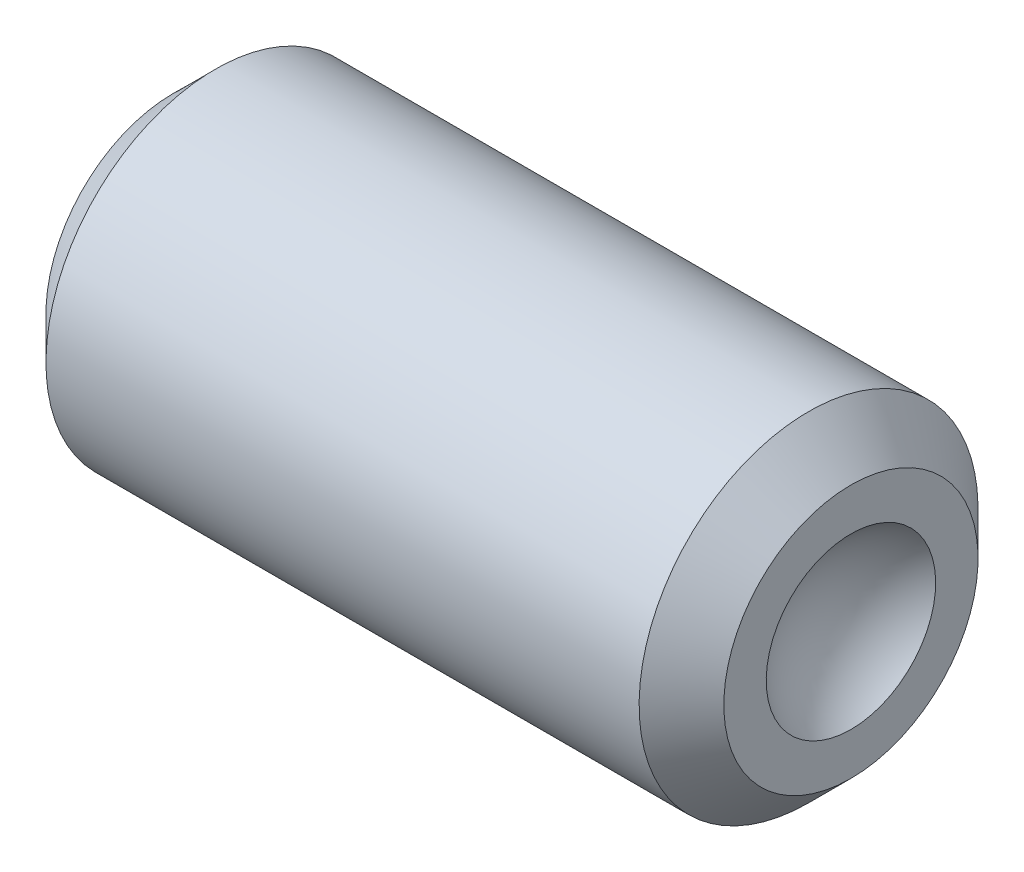
from build123d import *

# Parameters (mm, degrees)
CUT_EXTRUDE1_DEPTH = 6


with BuildPart() as part:
    # Sketch1 → Revolve1 (revolve)
    with BuildSketch(Plane.XY, mode=Mode.PRIVATE) as revolve1_sk:
        with BuildLine():
            Line((0, 0), (0, 1.5))
            Line((0, 1.5), (0.5, 2))
            Line((0.5, 2), (7.5, 2))
            Line((7.5, 2), (8, 1.5))
            Line((8, 1.5), (8, 1))
            ThreePointArc((8, 1), (7.631966011, 0.559016994), (7.5, 0))
            Line((7.5, 0), (0, 0))
        make_face()
    revolve(revolve1_sk.sketch.rotate(Axis((0, 0, 0), (1, 0, 0)), 180), axis=Axis((0, 0, 0), (1, 0, 0)))

    # Sketch2 → Cut-Extrude1 (cut)
    with BuildSketch(Plane.ZY):
        Polygon((0, 1.154700538), (-1, 0.577350269), (-1, -0.577350269), (0, -1.154700538), (1, -0.577350269), (1, 0.577350269), align=None)
    extrude(amount=-CUT_EXTRUDE1_DEPTH, mode=Mode.SUBTRACT)


solid = part.part
